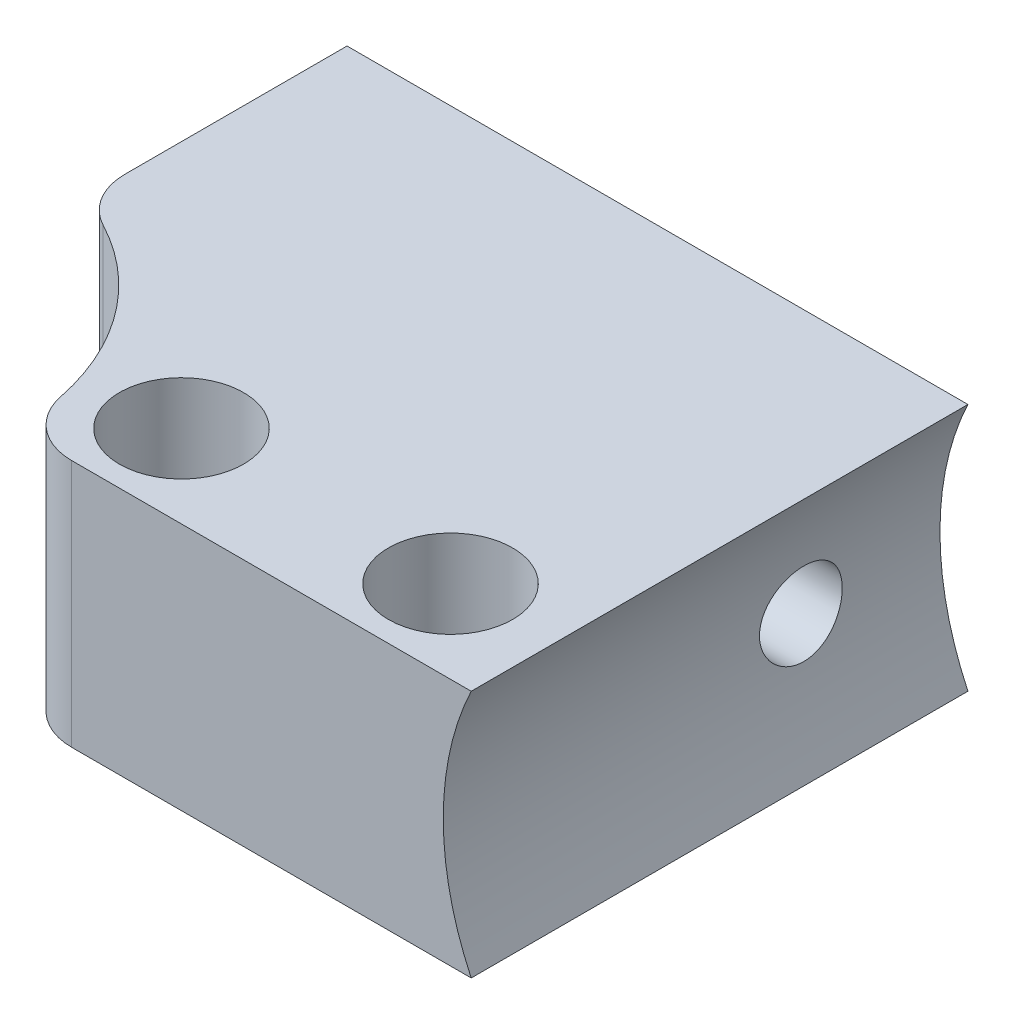
from build123d import *

# Parameters (mm, degrees)
SKETCH_1_R          = 3
EXTRUDE_1_DEPTH     = 12
CUT_EXTRUDE_1_DEPTH = 41.249223595
CUT_EXTRUDE_2_DEPTH = 23
SKETCH_4_R          = 2
CUT_EXTRUDE_3_DEPTH = 3
SKETCH_4_2_R        = 2
CUT_EXTRUDE_4_DEPTH = 41.249223625


with BuildPart() as part:
    # 草图1 → 凸台-拉伸1 (new body)
    with BuildSketch(Plane(origin=(0, 0, 0), x_dir=(1, 0, 0), z_dir=(0, 1, 0))):
        with BuildLine():
            Line((0, 0), (30, 0))
            Line((30, 0), (30, -24))
            Line((30, -24), (10.696938457, -24))
            ThreePointArc((10.696938457, -24), (8.799571861, -23.323790008), (7.757550765, -21.6))
            ThreePointArc((7.757550765, -21.6), (5.601317771, -16.801757364), (1.6, -13.386800671))
            ThreePointArc((1.6, -13.386800671), (0.430953484, -12.282694177), (0, -10.733500839))
            Line((0, -10.733500839), (0, 0))
        make_face()
        with Locations((12, -20)):
            Circle(SKETCH_1_R, mode=Mode.SUBTRACT)
        with Locations((25, -20)):
            Circle(SKETCH_1_R, mode=Mode.SUBTRACT)
    extrude(amount=EXTRUDE_1_DEPTH)

    # 草图2 → 切除-拉伸1 (cut, through all)
    with BuildSketch(Plane(origin=(0, 0, 0), x_dir=(-1, 0, 0), z_dir=(0, 0, -1))):
        with BuildLine():
            Line((-30, 12), (-30, 0))
            ThreePointArc((-30, 0), (-28.649110641, 6), (-30, 12))
        make_face()
    extrude(amount=-CUT_EXTRUDE_1_DEPTH, mode=Mode.SUBTRACT)

    # 草图3 → 切除-拉伸2 (cut)
    with BuildSketch(Plane.ZY):
        Polygon((0, 2.75), (0, 9.25), (4.253461365, 10), (4.253461365, 2), align=None)
    extrude(amount=-CUT_EXTRUDE_2_DEPTH, mode=Mode.SUBTRACT)

    # 草图4 → 切除-拉伸3 (cut)
    with BuildSketch(Plane.ZY):
        with BuildLine():
            Line((4.253461365, 10), (4.253461365, 2))
            ThreePointArc((4.253461365, 2), (11.421253901, 6), (4.253461365, 10))
        make_face()
        with Locations((6.721253901, 6)):
            Circle(SKETCH_4_R, mode=Mode.SUBTRACT)
    extrude(amount=-CUT_EXTRUDE_3_DEPTH, mode=Mode.SUBTRACT)

    # 草图4<2> → 切除-拉伸4 (cut, through all)
    with BuildSketch(Plane.ZY):
        with Locations((6.721253901, 6)):
            Circle(SKETCH_4_2_R)
    extrude(amount=-CUT_EXTRUDE_4_DEPTH, mode=Mode.SUBTRACT)


solid = part.part
